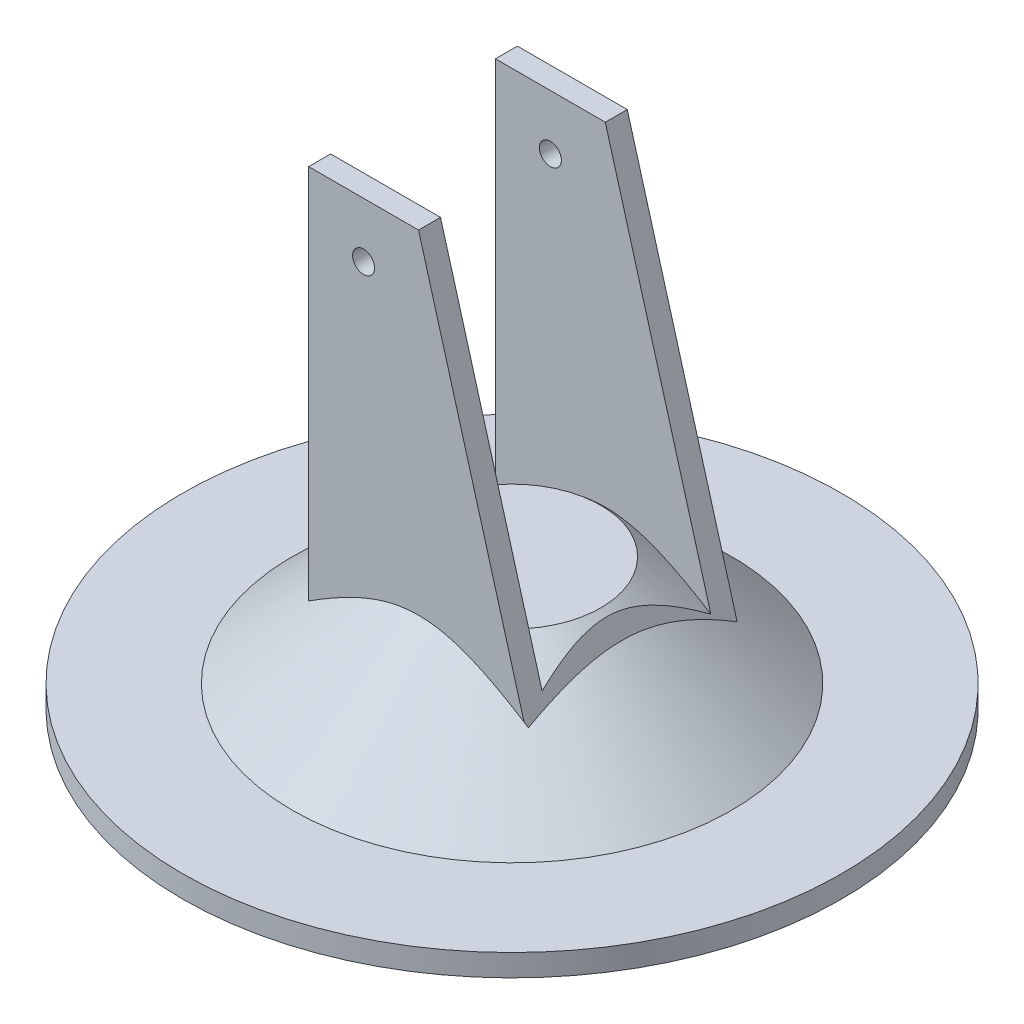
from build123d import *

# Parameters (mm, degrees)
SKETCH1_R           = 30
BOSS_EXTRUDE1_DEPTH = 2
SKETCH2_R           = 20
BOSS_EXTRUDE2_DEPTH = 10
BOSS_EXTRUDE2_TAPER = 50
SKETCH3_W           = 20
SKETCH3_H           = 2
BOSS_EXTRUDE3_DEPTH = 40
CUT_EXTRUDE1_REACH  = 67.598
CUT_EXTRUDE2_REACH  = 67.598
SKETCH7_R           = 1
SKETCH8_R           = 25
CUT_EXTRUDE3_DEPTH  = 2
CUT_EXTRUDE3_DRAFT  = -84


with BuildPart() as part:
    # Sketch1 → Boss-Extrude1 (new body)
    with BuildSketch(Plane(origin=(0, 0, 0), x_dir=(1, 0, 0), z_dir=(0, 1, 0))):
        with Locations(Location((0, -0.986006094, 0), (0, 0, 270))):
            Circle(SKETCH1_R)
    extrude(amount=BOSS_EXTRUDE1_DEPTH)

    # Sketch2 → Boss-Extrude2 (add)
    with BuildSketch(Plane(origin=(0, 2, 0), x_dir=(1, 0, 0), z_dir=(0, 1, 0))):
        with Locations((0, -0.986006094)):
            Circle(SKETCH2_R)
    extrude(amount=BOSS_EXTRUDE2_DEPTH, taper=BOSS_EXTRUDE2_TAPER)

    # Sketch3 → Boss-Extrude3 (add)
    with BuildSketch(Plane(origin=(0, 2, 0), x_dir=(1, 0, 0), z_dir=(0, 1, 0))):
        with Locations((0, 8.5)):
            Rectangle(SKETCH3_W, SKETCH3_H)
        with Locations((0, -8.5)):
            Rectangle(SKETCH3_W, SKETCH3_H)
    extrude(amount=BOSS_EXTRUDE3_DEPTH)

    # Cut-Extrude1: up to this face of the body (flat: up to its plane)
    cut_extrude1_end = Plane(part.part.faces().sort_by_distance((0, 26.093864251, 9.5))[0])
    # Sketch5 → Cut-Extrude1 (cut, up to the picked face)
    with BuildSketch(Plane(origin=(0, 0, -9.5), x_dir=(-1, 0, 0), z_dir=(0, 0, -1)), mode=Mode.PRIVATE) as cut_extrude1_sk1:
        Polygon((0, 42), (-10, 6.623548306), (-10, 42), align=None)
    cut_extrude1_tool1 = split(extrude(cut_extrude1_sk1.sketch, amount=-CUT_EXTRUDE1_REACH, mode=Mode.PRIVATE), bisect_by=cut_extrude1_end, keep=Keep.BOTH, mode=Mode.PRIVATE)
    add(cut_extrude1_tool1.solids().sort_by(Axis((6.666667, 30.207849, -9.5), (0, 0, 1)))[0], mode=Mode.SUBTRACT)

    # Cut-Extrude2: up to this face of the body (flat: up to its plane)
    cut_extrude2_end = Plane(part.part.faces().sort_by_distance((-2.565960576, 24.498389602, 9.5))[0])
    # Sketch7 → Cut-Extrude2 (cut, up to the picked face)
    with BuildSketch(Plane(origin=(0, 0, -9.5), x_dir=(-1, 0, 0), z_dir=(0, 0, -1)), mode=Mode.PRIVATE) as cut_extrude2_sk1:
        with Locations((5, 37)):
            Circle(SKETCH7_R)
    cut_extrude2_tool1 = split(extrude(cut_extrude2_sk1.sketch, amount=-CUT_EXTRUDE2_REACH, mode=Mode.PRIVATE), bisect_by=cut_extrude2_end, keep=Keep.BOTH, mode=Mode.PRIVATE)
    add(cut_extrude2_tool1.solids().sort_by(Axis((-5, 37, -9.5), (0, 0, 1)))[0], mode=Mode.SUBTRACT)


with BuildPart() as cut_extrude3_tool:
    # Sketch8 → Cut-Extrude3 (with draft: the straight prism first)
    with BuildSketch(Plane.XZ):
        with Locations((0, 0.986006094)):
            Circle(SKETCH8_R)
    extrude(amount=-CUT_EXTRUDE3_DEPTH)
    # Cut-Extrude3: the draft: its side faces are tilted about the plane it starts from
    cut_extrude3_sides = [cut_extrude3_tool.faces().sort_by_distance(p)[0] for p in [
        (-25, 1, 0.986006094),
    ]]
    draft(cut_extrude3_sides, Plane.XZ, CUT_EXTRUDE3_DRAFT)


with BuildPart() as part_1:
    add(part.part)

    # Cut-Extrude3: cut by cut_extrude3_tool
    add(cut_extrude3_tool.part, mode=Mode.SUBTRACT)


solid = part_1.part
